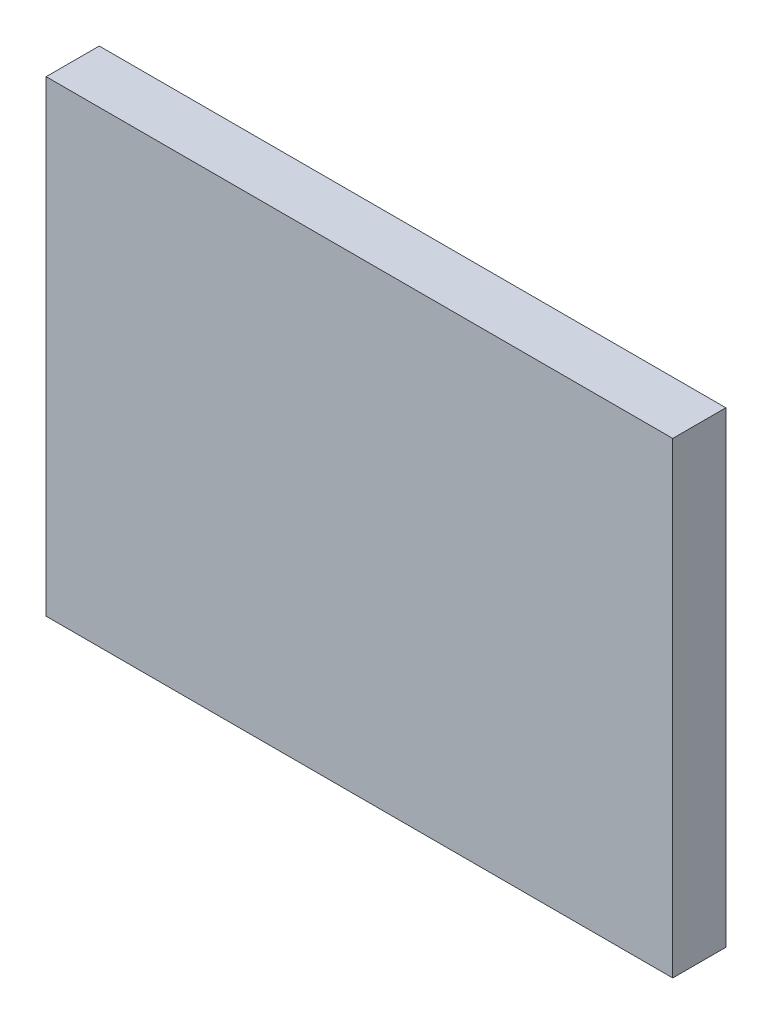
from build123d import *

# Parameters (mm, degrees)
ESBO_O1_W                = 59
ESBO_O1_H                = 44
RESSALTO_EXTRUS_O1_DEPTH = 5


with BuildPart() as part:
    # Esboço1 → Ressalto-extrusão1 (new body)
    with BuildSketch(Plane.XY):
        Rectangle(ESBO_O1_W, ESBO_O1_H)
    extrude(amount=RESSALTO_EXTRUS_O1_DEPTH)


solid = part.part
